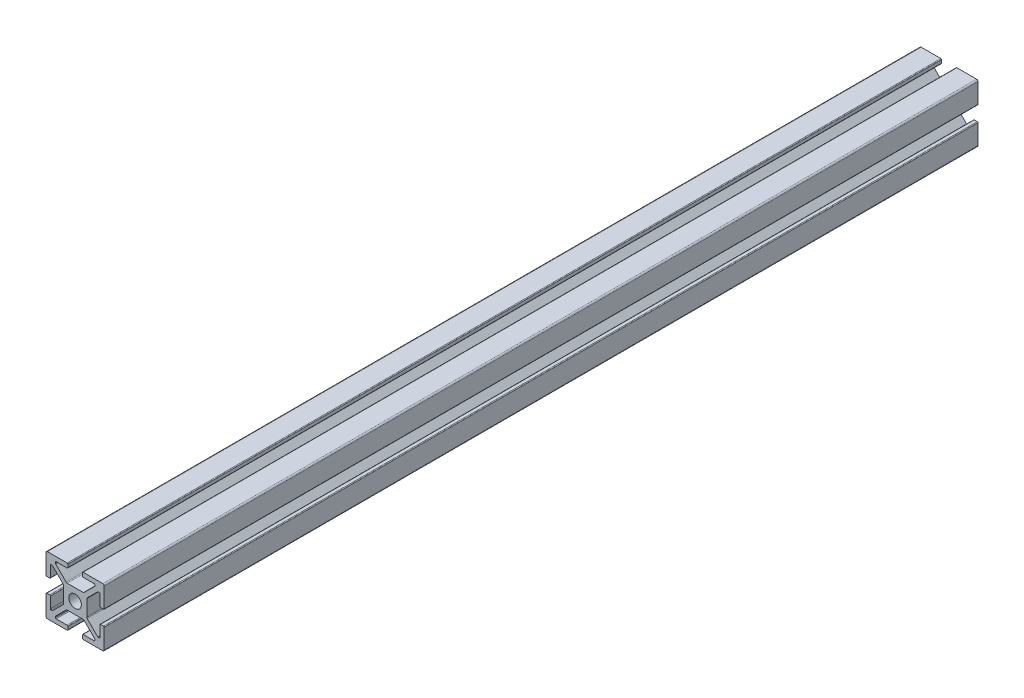
from build123d import *

# Parameters (mm, degrees)
SKETCH_1_R      = 2.15
EXTRUDE_1_DEPTH = 300


with BuildPart() as part:
    # Эскиз1 → Бобышка-Вытянуть1 (new body)
    with BuildSketch(Plane.XY):
        with BuildLine():
            Line((-10, -2.75), (-10, -9.5))
            ThreePointArc((-10, -9.5), (-9.853553391, -9.853553391), (-9.5, -10))
            Line((-9.5, -10), (-2.75, -10))
            ThreePointArc((-2.75, -10), (-2.573223305, -9.926776695), (-2.5, -9.75))
            Line((-2.5, -9.75), (-2.5, -8.75))
            ThreePointArc((-2.5, -8.75), (-2.573223305, -8.573223305), (-2.75, -8.5))
            Line((-2.75, -8.5), (-6.5, -8.5))
            ThreePointArc((-6.5, -8.5), (-6.676776695, -8.426776695), (-6.75, -8.25))
            Line((-6.75, -8.25), (-6.75, -7.914213562))
            ThreePointArc((-6.75, -7.914213562), (-6.730969883, -7.818542704), (-6.676776695, -7.737436867))
            Line((-6.676776695, -7.737436867), (-3.085786438, -4.146446609))
            ThreePointArc((-3.085786438, -4.146446609), (-2.923574763, -4.038060234), (-2.732233047, -4))
            Line((-2.732233047, -4), (2.732233047, -4))
            ThreePointArc((2.732233047, -4), (2.923574763, -4.038060234), (3.085786438, -4.146446609))
            Line((3.085786438, -4.146446609), (6.676776695, -7.737436867))
            ThreePointArc((6.676776695, -7.737436867), (6.730969883, -7.818542704), (6.75, -7.914213562))
            Line((6.75, -7.914213562), (6.75, -8.25))
            ThreePointArc((6.75, -8.25), (6.676776695, -8.426776695), (6.5, -8.5))
            Line((6.5, -8.5), (2.75, -8.5))
            ThreePointArc((2.75, -8.5), (2.573223305, -8.573223305), (2.5, -8.75))
            Line((2.5, -8.75), (2.5, -9.75))
            ThreePointArc((2.5, -9.75), (2.573223305, -9.926776695), (2.75, -10))
            Line((2.75, -10), (9.5, -10))
            ThreePointArc((9.5, -10), (9.853553391, -9.853553391), (10, -9.5))
            Line((10, -9.5), (10, -2.75))
            ThreePointArc((10, -2.75), (9.926776695, -2.573223305), (9.75, -2.5))
            Line((9.75, -2.5), (8.75, -2.5))
            ThreePointArc((8.75, -2.5), (8.573223305, -2.573223305), (8.5, -2.75))
            Line((8.5, -2.75), (8.5, -6.5))
            ThreePointArc((8.5, -6.5), (8.426776695, -6.676776695), (8.25, -6.75))
            Line((8.25, -6.75), (7.914213562, -6.75))
            ThreePointArc((7.914213562, -6.75), (7.818542704, -6.730969883), (7.737436867, -6.676776695))
            Line((7.737436867, -6.676776695), (4.146446609, -3.085786438))
            ThreePointArc((4.146446609, -3.085786438), (4.038060234, -2.923574763), (4, -2.732233047))
            Line((4, -2.732233047), (4, 2.732233047))
            ThreePointArc((4, 2.732233047), (4.038060234, 2.923574763), (4.146446609, 3.085786438))
            Line((4.146446609, 3.085786438), (7.737436867, 6.676776695))
            ThreePointArc((7.737436867, 6.676776695), (7.818542704, 6.730969883), (7.914213562, 6.75))
            Line((7.914213562, 6.75), (8.25, 6.75))
            ThreePointArc((8.25, 6.75), (8.426776695, 6.676776695), (8.5, 6.5))
            Line((8.5, 6.5), (8.5, 2.75))
            ThreePointArc((8.5, 2.75), (8.573223305, 2.573223305), (8.75, 2.5))
            Line((8.75, 2.5), (9.75, 2.5))
            ThreePointArc((9.75, 2.5), (9.926776695, 2.573223305), (10, 2.75))
            Line((10, 2.75), (10, 9.5))
            ThreePointArc((10, 9.5), (9.853553391, 9.853553391), (9.5, 10))
            Line((9.5, 10), (2.75, 10))
            ThreePointArc((2.75, 10), (2.573223305, 9.926776695), (2.5, 9.75))
            Line((2.5, 9.75), (2.5, 8.75))
            ThreePointArc((2.5, 8.75), (2.573223305, 8.573223305), (2.75, 8.5))
            Line((2.75, 8.5), (6.5, 8.5))
            ThreePointArc((6.5, 8.5), (6.676776695, 8.426776695), (6.75, 8.25))
            Line((6.75, 8.25), (6.75, 7.810660172))
            Line((6.75, 7.810660172), (3.012563133, 4.073223305))
            ThreePointArc((3.012563133, 4.073223305), (2.931457296, 4.019030117), (2.835786438, 4))
            Line((2.835786438, 4), (-2.732233047, 4))
            ThreePointArc((-2.732233047, 4), (-2.923574763, 4.038060234), (-3.085786438, 4.146446609))
            Line((-3.085786438, 4.146446609), (-6.676776695, 7.737436867))
            ThreePointArc((-6.676776695, 7.737436867), (-6.730969883, 7.818542704), (-6.75, 7.914213562))
            Line((-6.75, 7.914213562), (-6.75, 8.25))
            ThreePointArc((-6.75, 8.25), (-6.676776695, 8.426776695), (-6.5, 8.5))
            Line((-6.5, 8.5), (-2.75, 8.5))
            ThreePointArc((-2.75, 8.5), (-2.573223305, 8.573223305), (-2.5, 8.75))
            Line((-2.5, 8.75), (-2.5, 9.75))
            ThreePointArc((-2.5, 9.75), (-2.573223305, 9.926776695), (-2.75, 10))
            Line((-2.75, 10), (-9.5, 10))
            ThreePointArc((-9.5, 10), (-9.853553391, 9.853553391), (-10, 9.5))
            Line((-10, 9.5), (-10, 2.75))
            ThreePointArc((-10, 2.75), (-9.926776695, 2.573223305), (-9.75, 2.5))
            Line((-9.75, 2.5), (-8.75, 2.5))
            ThreePointArc((-8.75, 2.5), (-8.573223305, 2.573223305), (-8.5, 2.75))
            Line((-8.5, 2.75), (-8.5, 6.5))
            ThreePointArc((-8.5, 6.5), (-8.426776695, 6.676776695), (-8.25, 6.75))
            Line((-8.25, 6.75), (-7.914213562, 6.75))
            ThreePointArc((-7.914213562, 6.75), (-7.818542704, 6.730969883), (-7.737436867, 6.676776695))
            Line((-7.737436867, 6.676776695), (-4.146446609, 3.085786438))
            ThreePointArc((-4.146446609, 3.085786438), (-4.038060234, 2.923574763), (-4, 2.732233047))
            Line((-4, 2.732233047), (-4, -2.732233047))
            ThreePointArc((-4, -2.732233047), (-4.038060234, -2.923574763), (-4.146446609, -3.085786438))
            Line((-4.146446609, -3.085786438), (-7.737436867, -6.676776695))
            ThreePointArc((-7.737436867, -6.676776695), (-7.818542704, -6.730969883), (-7.914213562, -6.75))
            Line((-7.914213562, -6.75), (-8.25, -6.75))
            ThreePointArc((-8.25, -6.75), (-8.426776695, -6.676776695), (-8.5, -6.5))
            Line((-8.5, -6.5), (-8.5, -2.75))
            ThreePointArc((-8.5, -2.75), (-8.573223305, -2.573223305), (-8.75, -2.5))
            Line((-8.75, -2.5), (-9.75, -2.5))
            ThreePointArc((-9.75, -2.5), (-9.926776695, -2.573223305), (-10, -2.75))
        make_face()
        with Locations(Location((0, 0, 0), (0, 0, 180))):
            Circle(SKETCH_1_R, mode=Mode.SUBTRACT)
    extrude(amount=-EXTRUDE_1_DEPTH)


solid = part.part
